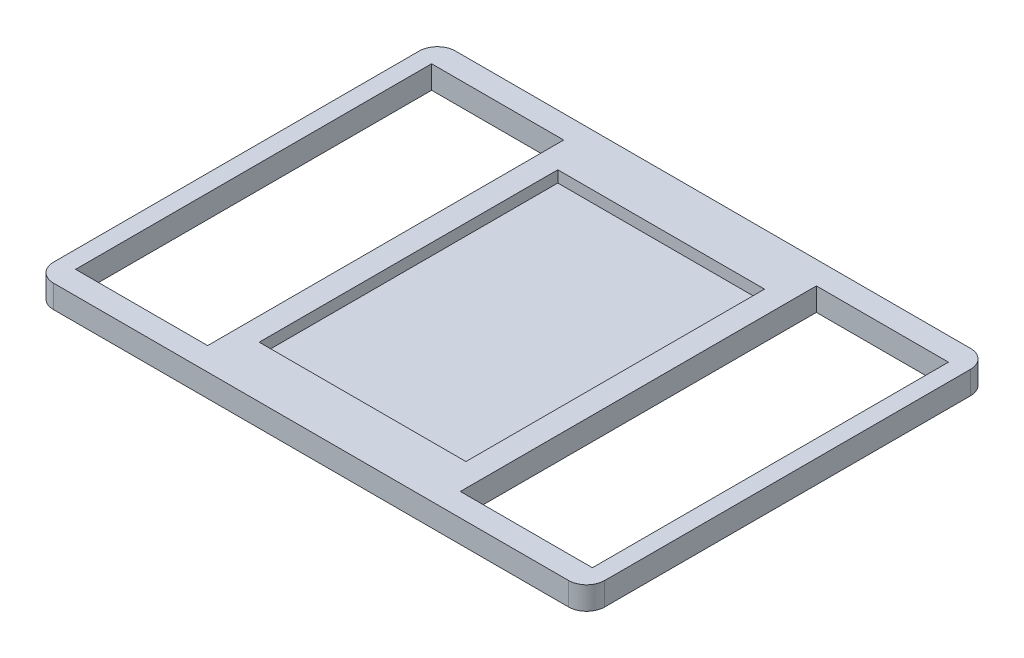
from build123d import *

# Parameters (mm, degrees)
SKETCH1_W           = 304.8
SKETCH1_H           = 222.25
BOSS_EXTRUDE1_DEPTH = 12.7
SKETCH2_W           = 73.025
SKETCH2_H           = 196.85
CUT_EXTRUDE1_DEPTH  = 12.7
SKETCH3_W           = 114.3
SKETCH3_H           = 165.1
CUT_EXTRUDE2_DEPTH  = 6.35
FILLET1_R           = 10


with BuildPart() as part:
    # Sketch1 → Boss-Extrude1 (new body)
    with BuildSketch(Plane(origin=(0, 0, 0), x_dir=(1, 0, 0), z_dir=(0, 1, 0))):
        with Locations((157.198920378, 111.125)):
            Rectangle(SKETCH1_W, SKETCH1_H)
    extrude(amount=BOSS_EXTRUDE1_DEPTH)

    # Sketch2 → Cut-Extrude1 (cut)
    with BuildSketch(Plane(origin=(0, 12.7, 0), x_dir=(1, 0, 0), z_dir=(0, 1, 0))):
        with Locations((50.836420378, 111.125)):
            Rectangle(SKETCH2_W, SKETCH2_H)
        with Locations((263.561420378, 111.125)):
            Rectangle(SKETCH2_W, SKETCH2_H)
    extrude(amount=-CUT_EXTRUDE1_DEPTH, mode=Mode.SUBTRACT)

    # Sketch3 → Cut-Extrude2 (cut)
    with BuildSketch(Plane(origin=(0, 12.7, 0), x_dir=(1, 0, 0), z_dir=(0, 1, 0))):
        with Locations((157.123394244, 111.125)):
            Rectangle(SKETCH3_W, SKETCH3_H)
    extrude(amount=-CUT_EXTRUDE2_DEPTH, mode=Mode.SUBTRACT)

    # Fillet1
    fillet1_edges = [part.edges().sort_by_distance(p)[0] for p in [
        (309.598920378, 6.35, -222.25),
        (309.598920378, 6.35, 0),
        (4.798920378, 6.35, 0),
        (4.798920378, 6.35, -222.25),
    ]]
    fillet(fillet1_edges, radius=FILLET1_R)


solid = part.part
